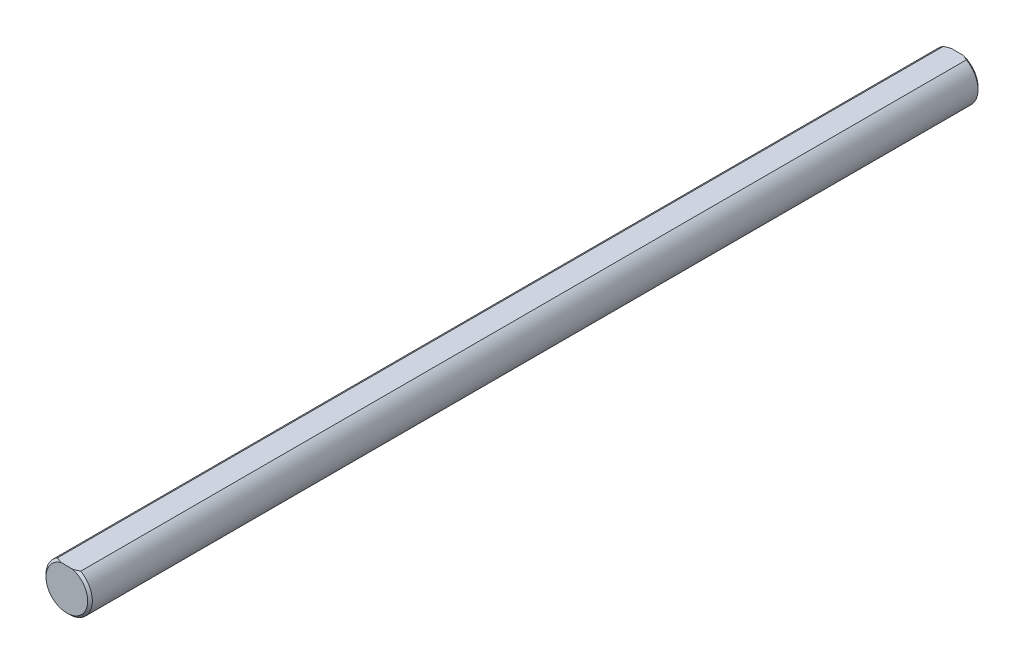
from build123d import *

# Parameters (mm, degrees)
BOSS_EXTRUDE2_DEPTH      = 152.4
BOSS_EXTRUDE2_DEPTH_BACK = 152.4
SKETCH3_R                = 7.9375
CUT_EXTRUDE5_DEPTH       = 153.812852249
CUT_EXTRUDE5_DEPTH_BACK  = 153.812852249
CHAMFER1_SIZE            = 0.79375


with BuildPart() as part:
    # Sketch3 → Boss-Extrude2 (new, two sides: drawn at the far end of the back side and taken through both)
    with BuildSketch(Plane.XY.offset(-BOSS_EXTRUDE2_DEPTH_BACK)):
        with Locations(Location((0, 0, 0), (0, 0, 180))):
            Circle(SKETCH3_R)
    extrude(amount=BOSS_EXTRUDE2_DEPTH + BOSS_EXTRUDE2_DEPTH_BACK)

    # Sketch10 → Cut-Extrude5 (cut, two sides: drawn at the far end of the back side and taken through both)
    with BuildSketch(Plane.XY.offset(-CUT_EXTRUDE5_DEPTH_BACK)):
        with BuildLine():
            Line((-3.96875, 6.874076643), (3.96875, 6.874076643))
            ThreePointArc((3.96875, 6.874076643), (0, 7.9375), (-3.96875, 6.874076643))
        make_face()
    extrude(amount=CUT_EXTRUDE5_DEPTH + CUT_EXTRUDE5_DEPTH_BACK, mode=Mode.SUBTRACT)

    # Chamfer1
    chamfer1_edges = [part.edges().sort_by_distance(p)[0] for p in [
        (0, -7.9375, -152.4),
        (0, -7.9375, 152.4),
    ]]
    chamfer(chamfer1_edges, length=CHAMFER1_SIZE)


solid = part.part
